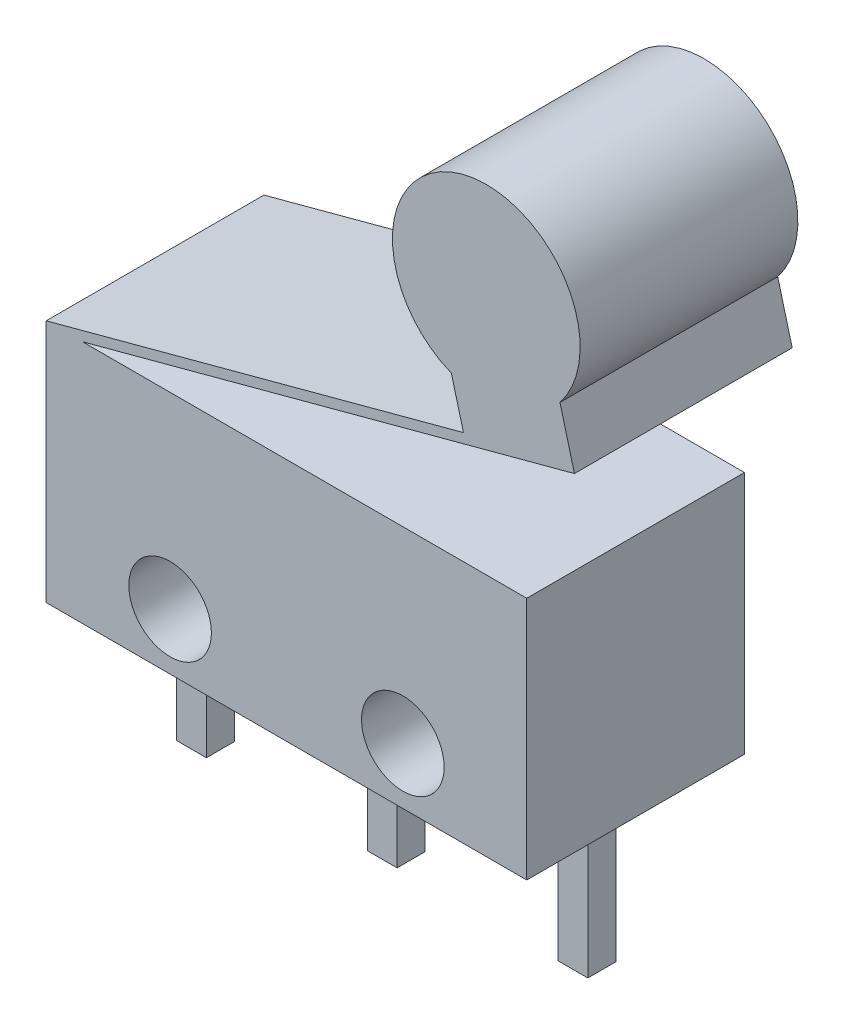
from build123d import *

# Parameters (mm, degrees)
SKETCH1_R           = 1.1
BOSS_EXTRUDE1_DEPTH = 5.8
SKETCH2_W           = 0.791647492
SKETCH2_H           = 0.74846672
BOSS_EXTRUDE2_DEPTH = 4


with BuildPart() as part:
    # Sketch1 → Boss-Extrude1 (new body)
    with BuildSketch(Plane.XY):
        with BuildLine():
            Line((0, 6.5), (11.115162843, 9.478298908))
            Line((11.115162843, 9.478298908), (10.79107709, 10.687803405))
            ThreePointArc((10.79107709, 10.687803405), (11.078349161, 15.423518447), (13.684925248, 11.459267786))
            Line((13.684925248, 11.459267786), (14.070629242, 10.011394697))
            Line((14.070629242, 10.011394697), (0.965925826, 6.5))
            Line((0.965925826, 6.5), (12.8, 6.5))
            Line((12.8, 6.5), (12.8, 0))
            Line((12.8, 0), (0, 0))
            Line((0, 0), (0, 6.5))
        make_face()
        with Locations((3.3, 1.5)):
            Circle(SKETCH1_R, mode=Mode.SUBTRACT)
        with Locations((9.5, 1.5)):
            Circle(SKETCH1_R, mode=Mode.SUBTRACT)
    extrude(amount=BOSS_EXTRUDE1_DEPTH)

    # Sketch2 → Boss-Extrude2 (add)
    with BuildSketch(Plane.XZ):
        with Locations((6.397743587, 2.872700046)):
            Rectangle(SKETCH2_W, SKETCH2_H)
        with Locations((1.317743587, 2.872700046)):
            Rectangle(SKETCH2_W, SKETCH2_H)
        with Locations((11.477743587, 2.872700046)):
            Rectangle(SKETCH2_W, SKETCH2_H)
    extrude(amount=BOSS_EXTRUDE2_DEPTH)


solid = part.part
